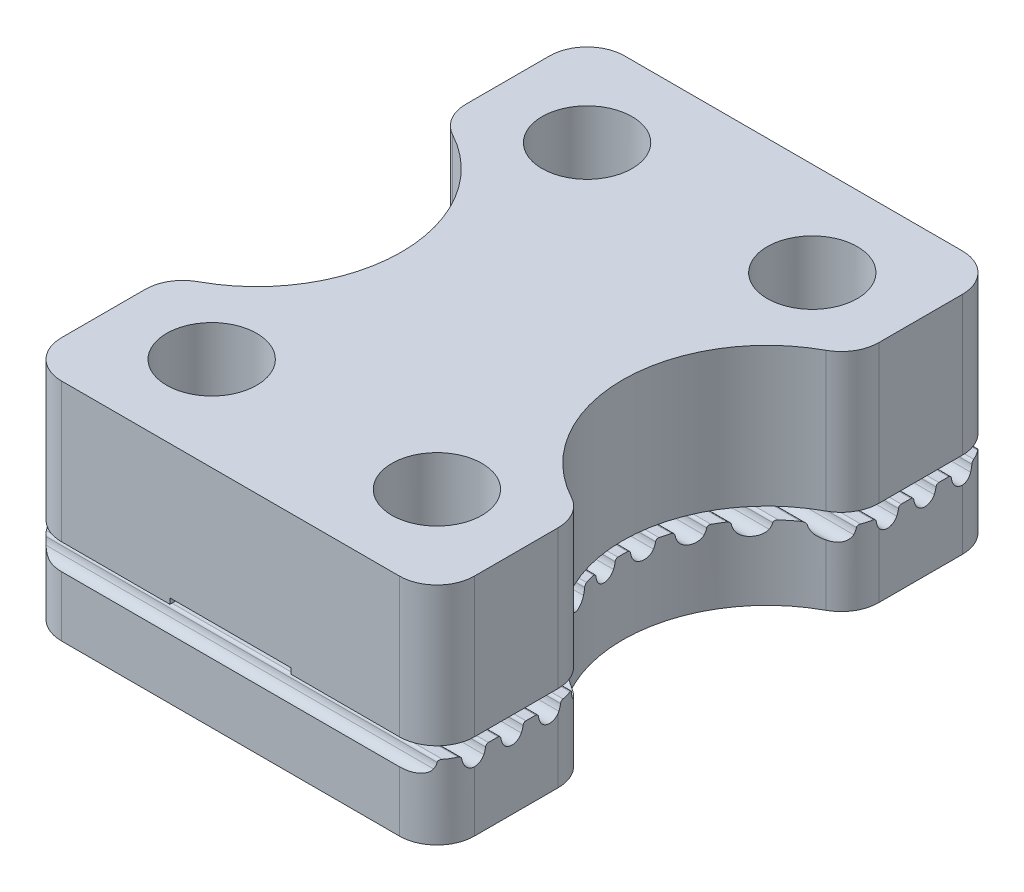
from build123d import *

# Parameters (mm, degrees)
BOSS_EXTRUDE1_DEPTH           = 12
CUT_EXTRUDE1_DEPTH            = 23.135943621
CUT_EXTRUDE1_DEPTH_BACK       = 23.135943621
SKETCH4_W                     = 2.4
SKETCH4_H                     = 12
M4_CLEARANCE_HOLE1_AT_2_COUNT = 2
M4_CLEARANCE_HOLE1_AT_2_PITCH = 12
M4_CLEARANCE_HOLE1_AT_3_COUNT = 2
M4_CLEARANCE_HOLE1_AT_3_PITCH = 20
M4_CLEARANCE_HOLE1_AT_4_COUNT = 2
M4_CLEARANCE_HOLE1_AT_4_PITCH = 23.323807579
CUT_EXTRUDE2_DEPTH            = 23.135943725
CUT_EXTRUDE2_DEPTH_BACK       = 23.135943725
SKETCH5_W                     = 6.45
SKETCH5_H                     = 0.3
FILLET1_R                     = 2
FILLET2_R                     = 2


with BuildPart() as part:
    # Sketch1 → Boss-Extrude1 (new body)
    with BuildSketch(Plane(origin=(0, 0, 0), x_dir=(1, 0, 0), z_dir=(0, 1, 0))):
        with BuildLine():
            Line((-11, -15), (11, -15))
            Line((11, -15), (11, -7.25))
            ThreePointArc((11, -7.25), (5.89374247, 0), (11, 7.25))
            Line((11, 7.25), (11, 15))
            Line((11, 15), (-11, 15))
            Line((-11, 15), (-11, 7.25))
            ThreePointArc((-11, 7.25), (-5.89374247, 0), (-11, -7.25))
            Line((-11, -7.25), (-11, -15))
        make_face()
    extrude(amount=-BOSS_EXTRUDE1_DEPTH)

    # Sketch2 → Cut-Extrude1 (cut, two sides: drawn at the far end of the back side and taken through both)
    with BuildSketch(Plane(origin=(0, 0, 0), x_dir=(0, 0, -1), z_dir=(1, 0, 0)).offset(-CUT_EXTRUDE1_DEPTH_BACK)):
        with BuildLine():
            Line((-15, -7.42), (15, -7.42))
            Line((15, -7.42), (16, -8.05))
            Line((16, -8.05), (15.740175425, -8.05))
            ThreePointArc((15.740175425, -8.05), (15.641268354, -8.087228588), (15.591456891, -8.180434783))
            ThreePointArc((15.591456891, -8.180434783), (15.557611714, -8.338062154), (15.498876404, -8.488202247))
            ThreePointArc((15.498876404, -8.488202247), (15, -8.8), (14.501123596, -8.488202247))
            ThreePointArc((14.501123596, -8.488202247), (14.442388286, -8.338062154), (14.408543109, -8.180434783))
            ThreePointArc((14.408543109, -8.180434783), (14.358731646, -8.087228588), (14.259824575, -8.05))
            Line((14.259824575, -8.05), (14, -8.05))
            Line((14, -8.05), (13.740175425, -8.05))
            ThreePointArc((13.740175425, -8.05), (13.641268354, -8.087228588), (13.591456891, -8.180434783))
            ThreePointArc((13.591456891, -8.180434783), (13.557611714, -8.338062154), (13.498876404, -8.488202247))
            ThreePointArc((13.498876404, -8.488202247), (13, -8.8), (12.501123596, -8.488202247))
            ThreePointArc((12.501123596, -8.488202247), (12.442388286, -8.338062154), (12.408543109, -8.180434783))
            ThreePointArc((12.408543109, -8.180434783), (12.358731646, -8.087228588), (12.259824575, -8.05))
            Line((12.259824575, -8.05), (12, -8.05))
            Line((12, -8.05), (11.740175425, -8.05))
            ThreePointArc((11.740175425, -8.05), (11.641268354, -8.087228588), (11.591456891, -8.180434783))
            ThreePointArc((11.591456891, -8.180434783), (11.557611714, -8.338062154), (11.498876404, -8.488202247))
            ThreePointArc((11.498876404, -8.488202247), (11, -8.8), (10.501123596, -8.488202247))
            ThreePointArc((10.501123596, -8.488202247), (10.442388286, -8.338062154), (10.408543109, -8.180434783))
            ThreePointArc((10.408543109, -8.180434783), (10.358731646, -8.087228588), (10.259824575, -8.05))
            Line((10.259824575, -8.05), (10, -8.05))
            Line((10, -8.05), (9.740175425, -8.05))
            ThreePointArc((9.740175425, -8.05), (9.641268354, -8.087228588), (9.591456891, -8.180434783))
            ThreePointArc((9.591456891, -8.180434783), (9.557611714, -8.338062154), (9.498876404, -8.488202247))
            ThreePointArc((9.498876404, -8.488202247), (9, -8.8), (8.501123596, -8.488202247))
            ThreePointArc((8.501123596, -8.488202247), (8.442388286, -8.338062154), (8.408543109, -8.180434783))
            ThreePointArc((8.408543109, -8.180434783), (8.358731646, -8.087228588), (8.259824575, -8.05))
            Line((8.259824575, -8.05), (8, -8.05))
            Line((8, -8.05), (7.740175425, -8.05))
            ThreePointArc((7.740175425, -8.05), (7.641268354, -8.087228588), (7.591456891, -8.180434783))
            ThreePointArc((7.591456891, -8.180434783), (7.557611714, -8.338062154), (7.498876404, -8.488202247))
            ThreePointArc((7.498876404, -8.488202247), (7, -8.8), (6.501123596, -8.488202247))
            ThreePointArc((6.501123596, -8.488202247), (6.442388286, -8.338062154), (6.408543109, -8.180434783))
            ThreePointArc((6.408543109, -8.180434783), (6.358731646, -8.087228588), (6.259824575, -8.05))
            Line((6.259824575, -8.05), (6, -8.05))
            Line((6, -8.05), (5.740175425, -8.05))
            ThreePointArc((5.740175425, -8.05), (5.641268354, -8.087228588), (5.591456891, -8.180434783))
            ThreePointArc((5.591456891, -8.180434783), (5.557611714, -8.338062154), (5.498876404, -8.488202247))
            ThreePointArc((5.498876404, -8.488202247), (5, -8.8), (4.501123596, -8.488202247))
            ThreePointArc((4.501123596, -8.488202247), (4.442388286, -8.338062154), (4.408543109, -8.180434783))
            ThreePointArc((4.408543109, -8.180434783), (4.358731646, -8.087228588), (4.259824575, -8.05))
            Line((4.259824575, -8.05), (4, -8.05))
            Line((4, -8.05), (3.740175425, -8.05))
            ThreePointArc((3.740175425, -8.05), (3.641268354, -8.087228588), (3.591456891, -8.180434783))
            ThreePointArc((3.591456891, -8.180434783), (3.557611714, -8.338062154), (3.498876404, -8.488202247))
            ThreePointArc((3.498876404, -8.488202247), (3, -8.8), (2.501123596, -8.488202247))
            ThreePointArc((2.501123596, -8.488202247), (2.442388286, -8.338062154), (2.408543109, -8.180434783))
            ThreePointArc((2.408543109, -8.180434783), (2.358731646, -8.087228588), (2.259824575, -8.05))
            Line((2.259824575, -8.05), (2, -8.05))
            Line((2, -8.05), (1.740175425, -8.05))
            ThreePointArc((1.740175425, -8.05), (1.641268354, -8.087228588), (1.591456891, -8.180434783))
            ThreePointArc((1.591456891, -8.180434783), (1.557611714, -8.338062154), (1.498876404, -8.488202247))
            ThreePointArc((1.498876404, -8.488202247), (1, -8.8), (0.501123596, -8.488202247))
            ThreePointArc((0.501123596, -8.488202247), (0.442388286, -8.338062154), (0.408543109, -8.180434783))
            ThreePointArc((0.408543109, -8.180434783), (0.358731646, -8.087228588), (0.259824575, -8.05))
            Line((0.259824575, -8.05), (0, -8.05))
            Line((0, -8.05), (-0.259824575, -8.05))
            ThreePointArc((-0.259824575, -8.05), (-0.358731646, -8.087228588), (-0.408543109, -8.180434783))
            ThreePointArc((-0.408543109, -8.180434783), (-0.442388286, -8.338062154), (-0.501123596, -8.488202247))
            ThreePointArc((-0.501123596, -8.488202247), (-1, -8.8), (-1.498876404, -8.488202247))
            ThreePointArc((-1.498876404, -8.488202247), (-1.557611714, -8.338062154), (-1.591456891, -8.180434783))
            ThreePointArc((-1.591456891, -8.180434783), (-1.641268354, -8.087228588), (-1.740175425, -8.05))
            Line((-1.740175425, -8.05), (-2, -8.05))
            Line((-2, -8.05), (-2.259824575, -8.05))
            ThreePointArc((-2.259824575, -8.05), (-2.358731646, -8.087228588), (-2.408543109, -8.180434783))
            ThreePointArc((-2.408543109, -8.180434783), (-2.442388286, -8.338062154), (-2.501123596, -8.488202247))
            ThreePointArc((-2.501123596, -8.488202247), (-3, -8.8), (-3.498876404, -8.488202247))
            ThreePointArc((-3.498876404, -8.488202247), (-3.557611714, -8.338062154), (-3.591456891, -8.180434783))
            ThreePointArc((-3.591456891, -8.180434783), (-3.641268354, -8.087228588), (-3.740175425, -8.05))
            Line((-3.740175425, -8.05), (-4, -8.05))
            Line((-4, -8.05), (-4.259824575, -8.05))
            ThreePointArc((-4.259824575, -8.05), (-4.358731646, -8.087228588), (-4.408543109, -8.180434783))
            ThreePointArc((-4.408543109, -8.180434783), (-4.442388286, -8.338062154), (-4.501123596, -8.488202247))
            ThreePointArc((-4.501123596, -8.488202247), (-5, -8.8), (-5.498876404, -8.488202247))
            ThreePointArc((-5.498876404, -8.488202247), (-5.557611714, -8.338062154), (-5.591456891, -8.180434783))
            ThreePointArc((-5.591456891, -8.180434783), (-5.641268354, -8.087228588), (-5.740175425, -8.05))
            Line((-5.740175425, -8.05), (-6, -8.05))
            Line((-6, -8.05), (-6.259824575, -8.05))
            ThreePointArc((-6.259824575, -8.05), (-6.358731646, -8.087228588), (-6.408543109, -8.180434783))
            ThreePointArc((-6.408543109, -8.180434783), (-6.442388286, -8.338062154), (-6.501123596, -8.488202247))
            ThreePointArc((-6.501123596, -8.488202247), (-7, -8.8), (-7.498876404, -8.488202247))
            ThreePointArc((-7.498876404, -8.488202247), (-7.557611714, -8.338062154), (-7.591456891, -8.180434783))
            ThreePointArc((-7.591456891, -8.180434783), (-7.641268354, -8.087228588), (-7.740175425, -8.05))
            Line((-7.740175425, -8.05), (-8, -8.05))
            Line((-8, -8.05), (-8.259824575, -8.05))
            ThreePointArc((-8.259824575, -8.05), (-8.358731646, -8.087228588), (-8.408543109, -8.180434783))
            ThreePointArc((-8.408543109, -8.180434783), (-8.442388286, -8.338062154), (-8.501123596, -8.488202247))
            ThreePointArc((-8.501123596, -8.488202247), (-9, -8.8), (-9.498876404, -8.488202247))
            ThreePointArc((-9.498876404, -8.488202247), (-9.557611714, -8.338062154), (-9.591456891, -8.180434783))
            ThreePointArc((-9.591456891, -8.180434783), (-9.641268354, -8.087228588), (-9.740175425, -8.05))
            Line((-9.740175425, -8.05), (-10, -8.05))
            Line((-10, -8.05), (-10.259824575, -8.05))
            ThreePointArc((-10.259824575, -8.05), (-10.358731646, -8.087228588), (-10.408543109, -8.180434783))
            ThreePointArc((-10.408543109, -8.180434783), (-10.442388286, -8.338062154), (-10.501123596, -8.488202247))
            ThreePointArc((-10.501123596, -8.488202247), (-11, -8.8), (-11.498876404, -8.488202247))
            ThreePointArc((-11.498876404, -8.488202247), (-11.557611714, -8.338062154), (-11.591456891, -8.180434783))
            ThreePointArc((-11.591456891, -8.180434783), (-11.641268354, -8.087228588), (-11.740175425, -8.05))
            Line((-11.740175425, -8.05), (-12, -8.05))
            Line((-12, -8.05), (-12.259824575, -8.05))
            ThreePointArc((-12.259824575, -8.05), (-12.358731646, -8.087228588), (-12.408543109, -8.180434783))
            ThreePointArc((-12.408543109, -8.180434783), (-12.442388286, -8.338062154), (-12.501123596, -8.488202247))
            ThreePointArc((-12.501123596, -8.488202247), (-13, -8.8), (-13.498876404, -8.488202247))
            ThreePointArc((-13.498876404, -8.488202247), (-13.557611714, -8.338062154), (-13.591456891, -8.180434783))
            ThreePointArc((-13.591456891, -8.180434783), (-13.641268354, -8.087228588), (-13.740175425, -8.05))
            Line((-13.740175425, -8.05), (-14, -8.05))
            Line((-14, -8.05), (-14.259824575, -8.05))
            ThreePointArc((-14.259824575, -8.05), (-14.358731646, -8.087228588), (-14.408543109, -8.180434783))
            ThreePointArc((-14.408543109, -8.180434783), (-14.442388286, -8.338062154), (-14.501123596, -8.488202247))
            ThreePointArc((-14.501123596, -8.488202247), (-15, -8.8), (-15.498876404, -8.488202247))
            ThreePointArc((-15.498876404, -8.488202247), (-15.557611714, -8.338062154), (-15.591456891, -8.180434783))
            ThreePointArc((-15.591456891, -8.180434783), (-15.641268354, -8.087228588), (-15.740175425, -8.05))
            Line((-15.740175425, -8.05), (-16, -8.05))
            Line((-16, -8.05), (-16, -7.42))
            Line((-16, -7.42), (-15, -7.42))
        make_face()
    extrude(amount=CUT_EXTRUDE1_DEPTH + CUT_EXTRUDE1_DEPTH_BACK, mode=Mode.SUBTRACT)


with BuildPart() as cut_extrude1_piece_1:
    # of the separate pieces the step leaves, piece 1, a body of its own (cut_extrude1_pieces)
    add(part.part.solids().sort_by_distance((-11, 0, 7.25))[0])


with BuildPart() as cut_extrude1_piece_2:
    # of the separate pieces the step leaves, piece 2, a body of its own (cut_extrude1_pieces)
    add(part.part.solids().sort_by_distance((-11, -8.740504793, 7.25))[0])


with BuildPart() as m4_clearance_hole1_tool:
    # Sketch4 → M4 Clearance Hole1 (revolve)
    with BuildSketch(Plane(origin=(6, 0, 10), x_dir=(0, 0, 1), z_dir=(1, 0, 0))):
        with Locations((1.2, 6)):
            Rectangle(SKETCH4_W, SKETCH4_H)
    m4_clearance_hole1 = revolve(axis=Axis((6, 6.35, 10), (0, -1, 0)))


with BuildPart() as cut_extrude1_piece_1_1:
    add(cut_extrude1_piece_1.part)

    # M4 Clearance Hole1: cut by m4_clearance_hole1_tool
    add(m4_clearance_hole1_tool.part, mode=Mode.SUBTRACT)


with BuildPart() as cut_extrude1_piece_2_1:
    add(cut_extrude1_piece_2.part)

    # M4 Clearance Hole1: cut by m4_clearance_hole1_tool
    add(m4_clearance_hole1_tool.part, mode=Mode.SUBTRACT)


with BuildPart() as m4_clearance_hole1_at_2_tool:
    # M4 Clearance Hole1 at 2: M4 Clearance Hole1 ×2
    with Locations(*[(-i * M4_CLEARANCE_HOLE1_AT_2_PITCH, 0, 0) for i in range(1, M4_CLEARANCE_HOLE1_AT_2_COUNT)]):
        add(m4_clearance_hole1)


with BuildPart() as cut_extrude1_piece_1_2:
    add(cut_extrude1_piece_1_1.part)

    # M4 Clearance Hole1 at 2: cut by m4_clearance_hole1_at_2_tool
    add(m4_clearance_hole1_at_2_tool.part, mode=Mode.SUBTRACT)


with BuildPart() as cut_extrude1_piece_2_2:
    add(cut_extrude1_piece_2_1.part)

    # M4 Clearance Hole1 at 2: cut by m4_clearance_hole1_at_2_tool
    add(m4_clearance_hole1_at_2_tool.part, mode=Mode.SUBTRACT)


with BuildPart() as m4_clearance_hole1_at_3_tool:
    # M4 Clearance Hole1 at 3: M4 Clearance Hole1 ×2
    with Locations(*[(0, 0, -i * M4_CLEARANCE_HOLE1_AT_3_PITCH) for i in range(1, M4_CLEARANCE_HOLE1_AT_3_COUNT)]):
        add(m4_clearance_hole1)


with BuildPart() as cut_extrude1_piece_1_3:
    add(cut_extrude1_piece_1_2.part)

    # M4 Clearance Hole1 at 3: cut by m4_clearance_hole1_at_3_tool
    add(m4_clearance_hole1_at_3_tool.part, mode=Mode.SUBTRACT)


with BuildPart() as cut_extrude1_piece_2_3:
    add(cut_extrude1_piece_2_2.part)

    # M4 Clearance Hole1 at 3: cut by m4_clearance_hole1_at_3_tool
    add(m4_clearance_hole1_at_3_tool.part, mode=Mode.SUBTRACT)


with BuildPart() as m4_clearance_hole1_at_4_tool:
    # M4 Clearance Hole1 at 4: M4 Clearance Hole1 ×2
    with Locations(*[Vector(-0.5144957554275266, 0, -0.8574929257125442) * (i * M4_CLEARANCE_HOLE1_AT_4_PITCH) for i in range(1, M4_CLEARANCE_HOLE1_AT_4_COUNT)]):
        add(m4_clearance_hole1)


with BuildPart() as cut_extrude1_piece_1_4:
    add(cut_extrude1_piece_1_3.part)

    # M4 Clearance Hole1 at 4: cut by m4_clearance_hole1_at_4_tool
    add(m4_clearance_hole1_at_4_tool.part, mode=Mode.SUBTRACT)

    # Sketch5 → Cut-Extrude2 (cut, two sides: drawn at the far end of the back side and taken through both)
    with BuildSketch(Plane.XY.offset(-CUT_EXTRUDE2_DEPTH_BACK)):
        with Locations((0, -7.27)):
            Rectangle(SKETCH5_W, SKETCH5_H)
    extrude(amount=CUT_EXTRUDE2_DEPTH + CUT_EXTRUDE2_DEPTH_BACK, mode=Mode.SUBTRACT)

    # Fillet1
    fillet1_edges = [cut_extrude1_piece_1_4.edges().sort_by_distance(p)[0] for p in [
        (11, -3.71, -15),
        (-11, -3.71, -15),
        (-11, -3.71, -7.25),
        (-11, -3.71, 7.25),
        (-11, -3.71, 15),
        (11, -3.71, 15),
        (11, -3.71, 7.25),
        (11, -3.71, -7.25),
    ]]
    fillet(fillet1_edges, radius=FILLET1_R)


with BuildPart() as cut_extrude1_piece_2_4:
    add(cut_extrude1_piece_2_3.part)

    # M4 Clearance Hole1 at 4: cut by m4_clearance_hole1_at_4_tool
    add(m4_clearance_hole1_at_4_tool.part, mode=Mode.SUBTRACT)

    # Fillet2
    fillet2_edges = [cut_extrude1_piece_2_4.edges().sort_by_distance(p)[0] for p in [
        (11, -10.4, -15),
        (-11, -10.4, -15),
        (-11, -10.370252397, -7.25),
        (-11, -10.370252397, 7.25),
        (-11, -10.4, 15),
        (11, -10.370252397, -7.25),
        (11, -10.370252397, 7.25),
        (11, -10.4, 15),
    ]]
    fillet(fillet2_edges, radius=FILLET2_R)


solid = Compound([cut_extrude1_piece_1_4.part, cut_extrude1_piece_2_4.part])
